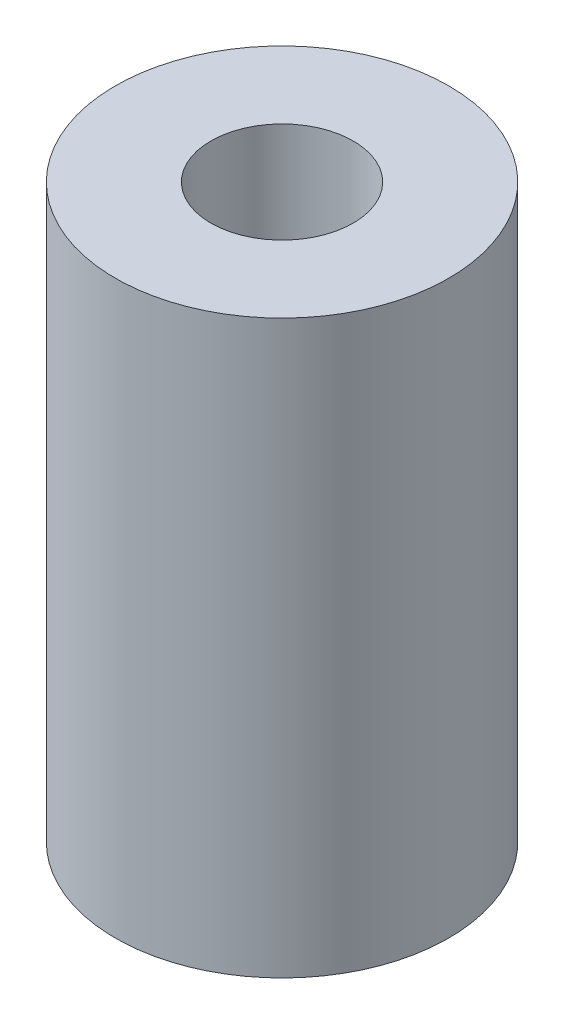
from build123d import *

# Parameters (mm, degrees)
SKETCH1_R             = 4.445
BOSS_EXTRUDE1_DEPTH   = 15.24
F_6_CLEARANCE_HOLE1_D = 3.7973


with BuildPart() as part:
    # Sketch1 → Boss-Extrude1 (new body)
    with BuildSketch(Plane(origin=(0, 0, 0), x_dir=(1, 0, 0), z_dir=(0, 1, 0))):
        with Locations(Location((0, 0, 0), (0, 0, 90))):
            Circle(SKETCH1_R)
    extrude(amount=BOSS_EXTRUDE1_DEPTH)

    # #6 Clearance Hole1 (through all)
    with Locations(Plane(origin=(0, 15.24, 0), x_dir=(1, 0, 0), z_dir=(0, 1, 0))):
        with Locations((0, 0)):
            Hole(F_6_CLEARANCE_HOLE1_D / 2)


solid = part.part
